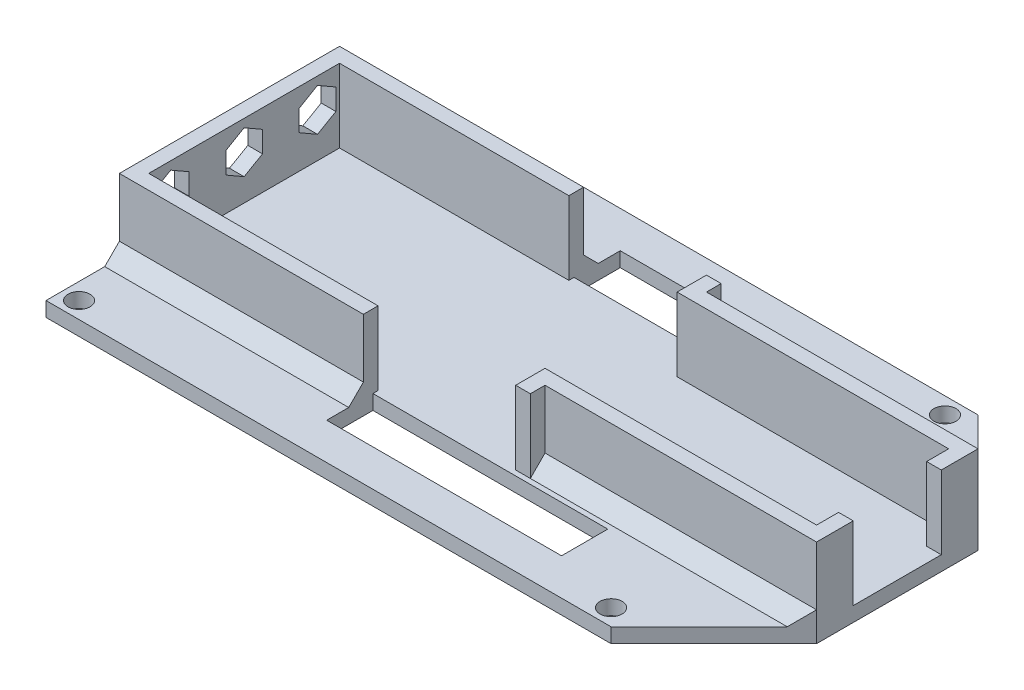
from build123d import *

# Parameters (mm, degrees)
SKETCH1_W           = 77
SKETCH1_H           = 50
SKETCH1_R           = 1.5
SKETCH1_W_2         = 32
SKETCH1_H_2         = 6.3
BOSS_EXTRUDE1_DEPTH = 2
BOSS_EXTRUDE2_DEPTH = 10
BOSS_EXTRUDE3_DEPTH = 2
CHAMFER1_SIZE       = 2
CUT_EXTRUDE1_REACH  = 97.131


with BuildPart() as part:
    # Sketch1 → Boss-Extrude1 (new body)
    with BuildSketch(Plane(origin=(0, 0, 0), x_dir=(1, 0, 0), z_dir=(0, 1, 0))):
        Rectangle(SKETCH1_W, SKETCH1_H)
        with Locations(Location((-36.25, 22.75, 0), (0, 0, 270))):
            Circle(SKETCH1_R, mode=Mode.SUBTRACT)
        with Locations(Location((36.25, 22.75, 0), (0, 0, 90))):
            Circle(SKETCH1_R, mode=Mode.SUBTRACT)
        with Locations(Location((36.25, -22.75, 0), (0, 0, 270))):
            Circle(SKETCH1_R, mode=Mode.SUBTRACT)
        with Locations(Location((-36.25, -22.75, 0), (0, 0, 90))):
            Circle(SKETCH1_R, mode=Mode.SUBTRACT)
        with Locations((10.75, 16.85)):
            Rectangle(SKETCH1_W_2, SKETCH1_H_2, mode=Mode.SUBTRACT)
        with Locations((10.75, -16.85)):
            Rectangle(SKETCH1_W_2, SKETCH1_H_2, mode=Mode.SUBTRACT)
    extrude(amount=BOSS_EXTRUDE1_DEPTH)

    # Sketch2 → Boss-Extrude2 (add)
    with BuildSketch(Plane(origin=(0, 2, 0), x_dir=(1, 0, 0), z_dir=(0, 1, 0))):
        Polygon((-38.5, 15), (-38.5, -15), (-5.25, -15), (-5.25, -13.7), (-5.25, -13), (-36.5, -13), (-36.5, 13), (-5.25, 13), (-5.25, 13.7), (-5.25, 15), align=None)
        Polygon((15.5, 13), (13.5, 13), (13.5, 9), (38.5, 9), (38.5, 11), (15.5, 11), align=None)
        Polygon((38.5, 11), (38.5, 9), (50.5, 9), (50.5, 6), (52.5, 6), (52.5, 11), align=None)
        Polygon((50.5, -9), (38.5, -9), (38.5, -11), (52.5, -11), (52.5, -6), (50.5, -6), align=None)
        Polygon((13.5, -9), (13.5, -13), (15.5, -13), (15.5, -11), (38.5, -11), (38.5, -9), align=None)
    extrude(amount=BOSS_EXTRUDE2_DEPTH)

    # Sketch3 → Boss-Extrude3 (add)
    with BuildSketch(Plane.XZ.offset(-2)):
        Polygon((38.5, 25), (52.5, 11), (52.5, -11), (38.5, -25), align=None)
    extrude(amount=BOSS_EXTRUDE3_DEPTH)

    # Chamfer1
    chamfer1_edges = [part.edges().sort_by_distance(p)[0] for p in [
        (-21.875, 2, -15),
        (34, 2, -11),
        (34, 2, 11),
        (-21.875, 2, 15),
    ]]
    chamfer(chamfer1_edges, length=CHAMFER1_SIZE)

    # Sketch4 → Cut-Extrude1 (cut, up to next)
    with BuildSketch(Plane.ZY.offset(38.5), mode=Mode.PRIVATE) as cut_extrude1_sk1:
        Polygon((-7.5, 6.556624327), (-7.5, 9.443375673), (-10, 10.886751346), (-12.5, 9.443375673), (-12.5, 6.556624327), (-10, 5.113248654), align=None)
    cut_extrude1_tool1 = extrude(cut_extrude1_sk1.sketch, amount=-CUT_EXTRUDE1_REACH, mode=Mode.PRIVATE) & part.part
    # Sketch4 → Cut-Extrude1 (cut, up to next)
    with BuildSketch(Plane.ZY.offset(38.5), mode=Mode.PRIVATE) as cut_extrude1_sk2:
        Polygon((0, 10.886751346), (0, 5.113248654), (2.5, 6.556624327), (2.5, 9.443375673), align=None)
    cut_extrude1_tool2 = extrude(cut_extrude1_sk2.sketch, amount=-CUT_EXTRUDE1_REACH, mode=Mode.PRIVATE) & part.part
    # Sketch4 → Cut-Extrude1 (cut, up to next)
    with BuildSketch(Plane.ZY.offset(38.5), mode=Mode.PRIVATE) as cut_extrude1_sk3:
        Polygon((-2.5, 6.556624327), (0, 5.113248654), (0, 10.886751346), (-2.5, 9.443375673), align=None)
    cut_extrude1_tool3 = extrude(cut_extrude1_sk3.sketch, amount=-CUT_EXTRUDE1_REACH, mode=Mode.PRIVATE) & part.part
    # Sketch4 → Cut-Extrude1 (cut, up to next)
    with BuildSketch(Plane.ZY.offset(38.5), mode=Mode.PRIVATE) as cut_extrude1_sk4:
        Polygon((12.5, 6.556624327), (12.5, 9.443375673), (10, 10.886751346), (7.5, 9.443375673), (7.5, 6.556624327), (10, 5.113248654), align=None)
    cut_extrude1_tool4 = extrude(cut_extrude1_sk4.sketch, amount=-CUT_EXTRUDE1_REACH, mode=Mode.PRIVATE) & part.part
    add(cut_extrude1_tool1.solids().sort_by_distance((-38.5, 8, -10))[0], mode=Mode.SUBTRACT)
    add(cut_extrude1_tool2.solids().sort_by_distance((-38.5, 8, 1.111111))[0], mode=Mode.SUBTRACT)
    add(cut_extrude1_tool3.solids().sort_by_distance((-38.5, 8, -1.111111))[0], mode=Mode.SUBTRACT)
    add(cut_extrude1_tool4.solids().sort_by_distance((-38.5, 8, 10))[0], mode=Mode.SUBTRACT)


solid = part.part
